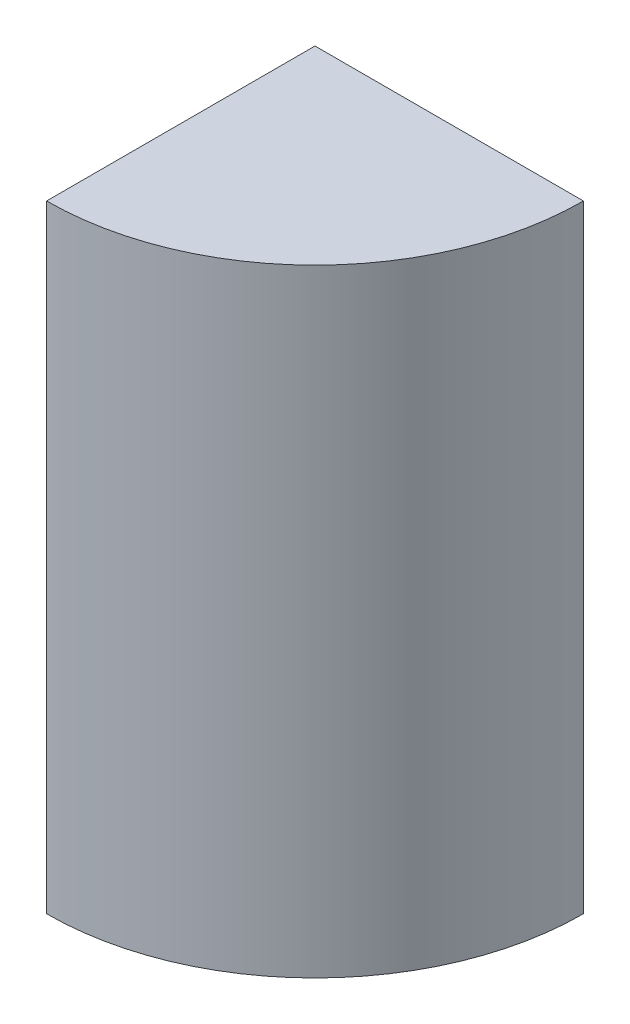
from build123d import *

# Parameters (mm, degrees)
BOSS_EXTRUDE1_DEPTH = 584.2


with BuildPart() as part:
    # Sketch1 → Boss-Extrude1 (new body)
    with BuildSketch(Plane(origin=(0, 0, 0), x_dir=(1, 0, 0), z_dir=(0, 1, 0))):
        with BuildLine():
            ThreePointArc((254, 0), (179.605122421, -179.605122421), (0, -254))
            Line((0, -254), (0, 0))
            Line((0, 0), (254, 0))
        make_face()
    extrude(amount=BOSS_EXTRUDE1_DEPTH)


solid = part.part
